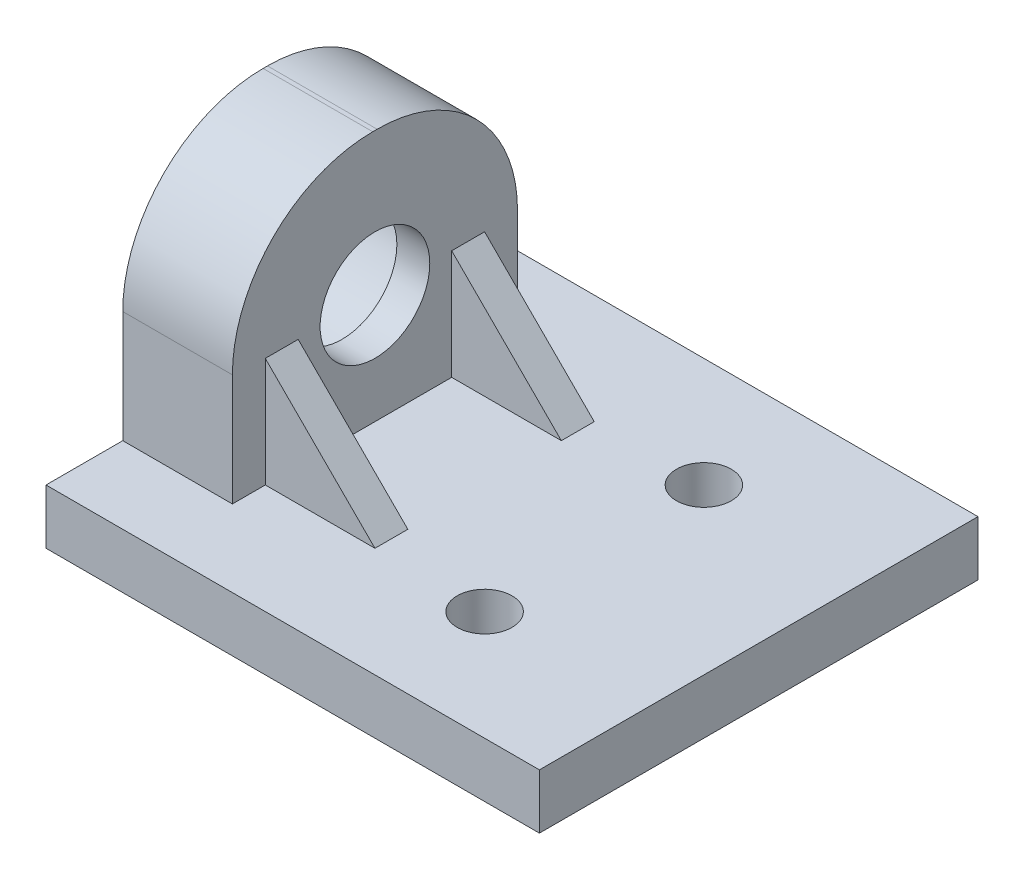
from build123d import *

# Parameters (mm, degrees)
SKETCH1_W           = 57.15
SKETCH1_H           = 50.8
BOSS_EXTRUDE1_DEPTH = 25.4
SKETCH2_W           = 50.8
SKETCH2_H           = 12.7
CUT_EXTRUDE1_DEPTH  = 81.572467382
SKETCH4_R           = 10.9982
BOSS_EXTRUDE2_DEPTH = 12.7
BOSS_EXTRUDE3_START = -3.81
SKETCH5_R           = 10.9982
SKETCH5_R_2         = 6.35
BOSS_EXTRUDE3_DEPTH = 3.81
SKETCH8_R           = 3.175
CUT_EXTRUDE2_DEPTH  = 94.962836271
SKETCH9_W           = 12.7
SKETCH9_H           = 3.81
BOSS_EXTRUDE5_DEPTH = 12.7
CUT_EXTRUDE3_DEPTH  = 88.749556124
CUT_EXTRUDE4_DEPTH  = 94.962836271


with BuildPart() as part:
    # Sketch1 → Boss-Extrude1 (new body)
    with BuildSketch(Plane(origin=(0, 0, 0), x_dir=(1, 0, 0), z_dir=(0, 1, 0))):
        with Locations((28.575, 25.4)):
            Rectangle(SKETCH1_W, SKETCH1_H)
    extrude(amount=BOSS_EXTRUDE1_DEPTH)

    # Sketch2 → Cut-Extrude1 (cut, through all)
    with BuildSketch(Plane.XY):
        with Locations((31.75, 12.7)):
            Rectangle(SKETCH2_W, SKETCH2_H)
    extrude(amount=-CUT_EXTRUDE1_DEPTH, mode=Mode.SUBTRACT)

    # Sketch4 → Boss-Extrude2 (add)
    with BuildSketch(Plane.ZY):
        with BuildLine():
            Line((-41.91, 25.4), (-8.89, 25.4))
            Line((-8.89, 25.4), (-8.89, 38.354))
            ThreePointArc((-8.89, 38.354), (-13.651272165, 49.848727835), (-25.146, 54.61))
            Line((-25.146, 54.61), (-25.654, 54.61))
            ThreePointArc((-25.654, 54.61), (-37.148727835, 49.848727835), (-41.91, 38.354))
            Line((-41.91, 38.354), (-41.91, 25.4))
        make_face()
        with Locations((-25.4, 38.1)):
            Circle(SKETCH4_R, mode=Mode.SUBTRACT)
    extrude(amount=-BOSS_EXTRUDE2_DEPTH)

    # Sketch5 → Boss-Extrude3 (add)
    with BuildSketch(Plane(origin=(12.7, 0, 0), x_dir=(0, 0, -1), z_dir=(1, 0, 0)).offset(BOSS_EXTRUDE3_START)):
        with Locations(Location((25.4, 38.1, 0), (0, 0, 180))):
            Circle(SKETCH5_R)
        with Locations((25.4, 38.1)):
            Circle(SKETCH5_R_2, mode=Mode.SUBTRACT)
    extrude(amount=BOSS_EXTRUDE3_DEPTH)

    # Sketch8 → Cut-Extrude2 (cut, through all)
    with BuildSketch(Plane.XZ):
        with Locations(Location((38.1, -38.1, 0), (0, 0, 270))):
            Circle(SKETCH8_R)
        with Locations(Location((38.1, -12.7, 0), (0, 0, 270))):
            Circle(SKETCH8_R)
    extrude(amount=-CUT_EXTRUDE2_DEPTH, mode=Mode.SUBTRACT)

    # Sketch9 → Boss-Extrude5 (add)
    with BuildSketch(Plane(origin=(0, 25.4, 0), x_dir=(1, 0, 0), z_dir=(0, 1, 0))):
        with Locations((19.05, 14.605)):
            Rectangle(SKETCH9_W, SKETCH9_H)
        with Locations((19.05, 36.195)):
            Rectangle(SKETCH9_W, SKETCH9_H)
    extrude(amount=BOSS_EXTRUDE5_DEPTH)

    # Sketch10 → Cut-Extrude3 (cut, through all)
    with BuildSketch(Plane.XY.offset(-12.7)):
        Polygon((25.4, 25.4), (25.4, 38.1), (12.7, 38.1), align=None)
    extrude(amount=-CUT_EXTRUDE3_DEPTH, mode=Mode.SUBTRACT)

    # Sketch11 → Cut-Extrude4 (cut, through all)
    with BuildSketch(Plane.XY):
        Polygon((6.35, 6.35), (6.35, 19.05), (0, 19.05), (0, 0), (57.15, 0), (57.15, 6.35), align=None)
    extrude(amount=-CUT_EXTRUDE4_DEPTH, mode=Mode.SUBTRACT)


solid = part.part
